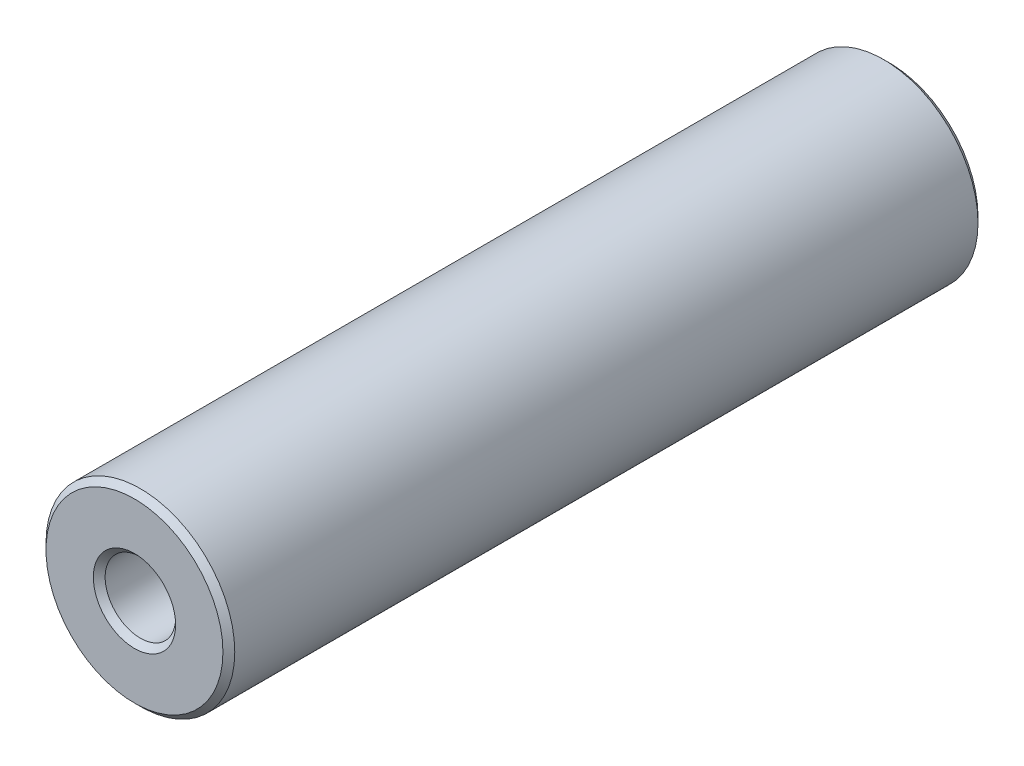
from build123d import *

# Parameters (mm, degrees)
BOSS_EXTRUDE1_DEPTH      = 19.05
BOSS_EXTRUDE1_DEPTH_BACK = 19.05
SKETCH3_R                = 4.7625
SKETCH3_R_2              = 1.778
CHAMFER1_SIZE            = 0.29845


with BuildPart() as part:
    # Sketch3 → Boss-Extrude1 (new, two sides: drawn at the far end of the back side and taken through both)
    with BuildSketch(Plane.XY.offset(-BOSS_EXTRUDE1_DEPTH_BACK)):
        Circle(SKETCH3_R)
        Circle(SKETCH3_R_2, mode=Mode.SUBTRACT)
    extrude(amount=BOSS_EXTRUDE1_DEPTH + BOSS_EXTRUDE1_DEPTH_BACK)

    # Chamfer1
    chamfer1_edges = [part.edges().sort_by_distance(p)[0] for p in [
        (-4.7625, 0, -19.05),
        (-1.778, 0, -19.05),
        (-4.7625, 0, 19.05),
        (-1.778, 0, 19.05),
    ]]
    chamfer(chamfer1_edges, length=CHAMFER1_SIZE)


solid = part.part
